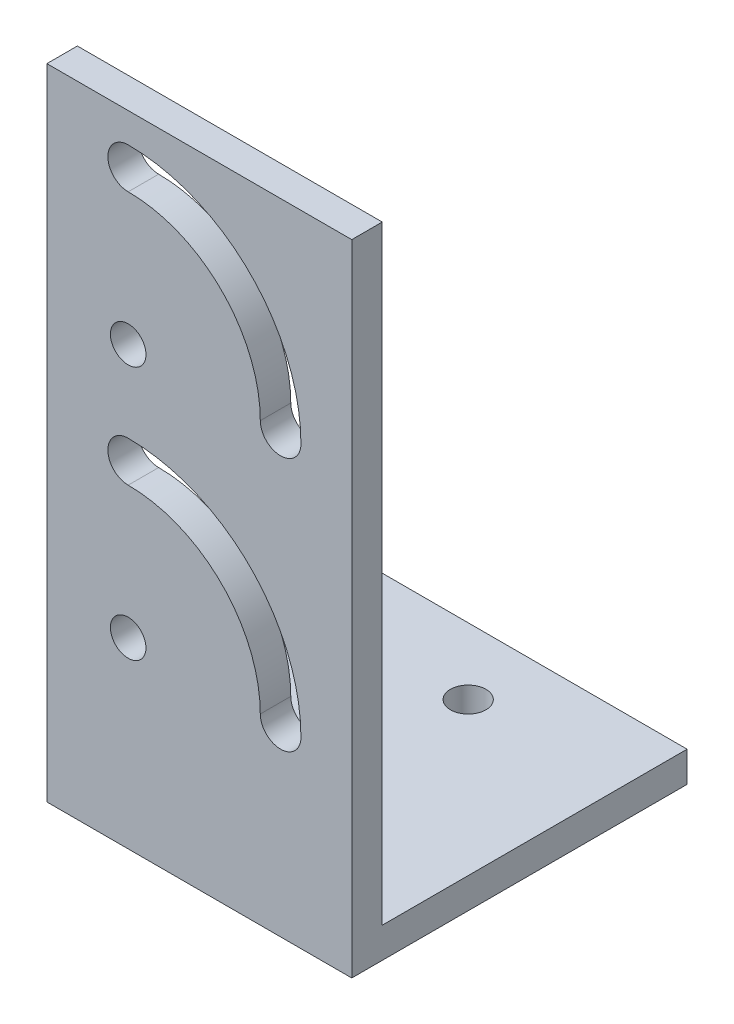
from build123d import *

# Parameters (mm, degrees)
SKETCH_1_W          = 30
SKETCH_1_H          = 30
EXTRUDE_1_DEPTH     = 3
SKETCH_2_R          = 1.75
CUT_EXTRUDE_1_DEPTH = 3
SKETCH_3_W          = 30
SKETCH_3_H          = 62.924190463
EXTRUDE_2_DEPTH     = 3
SKETCH_4_R          = 1.75
CUT_EXTRUDE_2_DEPTH = 3


with BuildPart() as part:
    # 草图1 → 凸台-拉伸1 (new body)
    with BuildSketch(Plane(origin=(0, 0, 0), x_dir=(1, 0, 0), z_dir=(0, 1, 0))):
        Rectangle(SKETCH_1_W, SKETCH_1_H)
    extrude(amount=EXTRUDE_1_DEPTH)

    # 草图2 → 切除-拉伸1 (cut)
    with BuildSketch(Plane(origin=(0, 3, 0), x_dir=(1, 0, 0), z_dir=(0, 1, 0))):
        with Locations(Location((0, -6.542683553, 0), (0, 0, 270))):
            Circle(SKETCH_2_R)
        with Locations(Location((0, 8.457316447, 0), (0, 0, 270))):
            Circle(SKETCH_2_R)
    extrude(amount=-CUT_EXTRUDE_1_DEPTH, mode=Mode.SUBTRACT)

    # 草图3 → 凸台-拉伸2 (add)
    with BuildSketch(Plane.XY.offset(15)):
        with Locations((0, 31.462095232)):
            Rectangle(SKETCH_3_W, SKETCH_3_H)
    extrude(amount=EXTRUDE_2_DEPTH)

    # 草图4 → 切除-拉伸2 (cut)
    with BuildSketch(Plane.XY.offset(18)):
        with Locations((-7, 18)):
            Circle(SKETCH_4_R)
        with Locations((-7, 43)):
            Circle(SKETCH_4_R)
        with BuildLine():
            ThreePointArc((6, 18), (2.192388155, 27.192388155), (-7, 31))
            ThreePointArc((-7, 31), (-9, 33), (-7, 35))
            ThreePointArc((-7, 35), (5.02081528, 30.02081528), (10, 18))
            ThreePointArc((10, 18), (8, 16), (6, 18))
        make_face()
        with BuildLine():
            ThreePointArc((6, 43), (8, 41), (10, 43))
            ThreePointArc((10, 43), (5.02081528, 55.02081528), (-7, 60))
            ThreePointArc((-7, 60), (-9, 58), (-7, 56))
            ThreePointArc((-7, 56), (2.192388155, 52.192388155), (6, 43))
        make_face()
    extrude(amount=-CUT_EXTRUDE_2_DEPTH, mode=Mode.SUBTRACT)


solid = part.part
